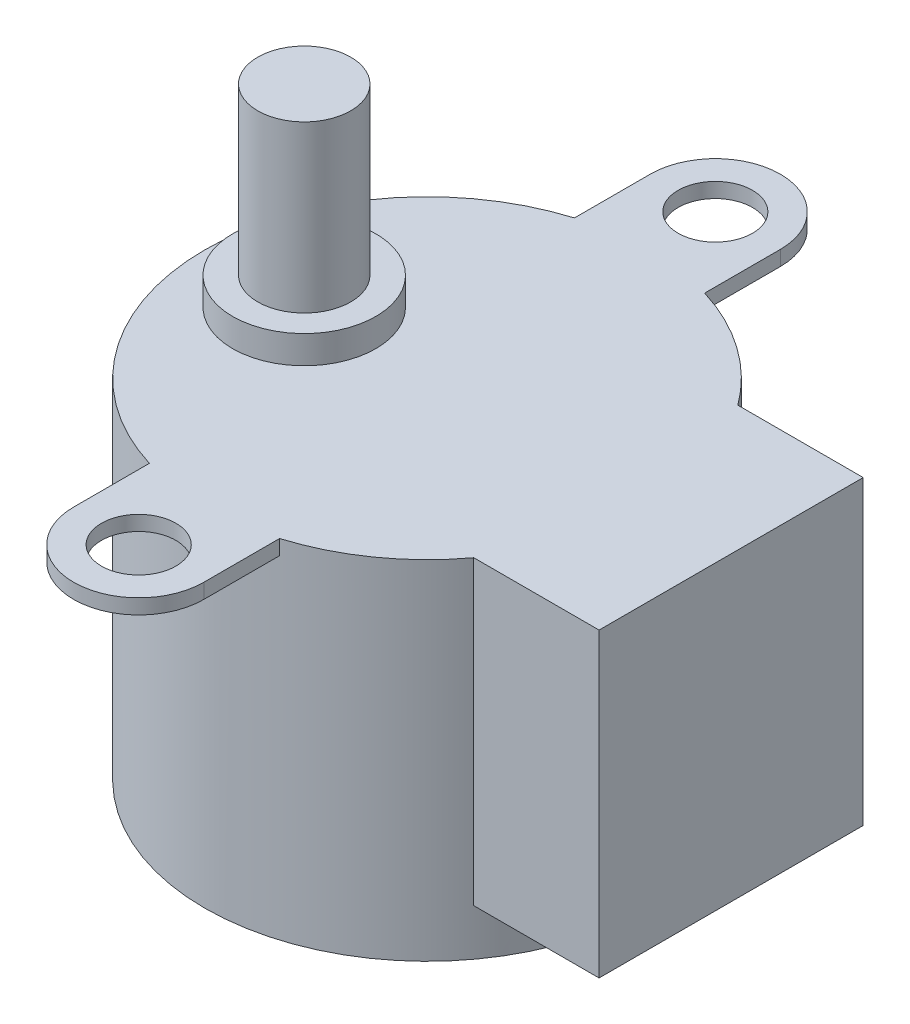
from build123d import *

# Parameters (mm, degrees)
SKETCH_1_R       = 11.95
EXTRUDE_1_DEPTH  = 18.7
EXTRUDE_START    = -16.2
EXTRUDE_8_DEPTH  = 16.2
EXTRUDE_START_2  = -0.8
SKETCH_3_R       = 2
EXTRUDE_9_DEPTH  = 0.8
SKETCH_4_R       = 3.85
EXTRUDE_10_DEPTH = 1.5
SKETCH_5_R       = 2.5
EXTRUDE_11_DEPTH = 8.9


with BuildPart() as part:
    # 草图1 → 凸台-拉伸1 (new body)
    with BuildSketch(Plane(origin=(0, 0, 0), x_dir=(1, 0, 0), z_dir=(0, 1, 0))):
        with Locations(Location((0, 0, 0), (0, 0, 270))):
            Circle(SKETCH_1_R)
    extrude(amount=EXTRUDE_1_DEPTH)

    # 草图2 → 凸台-拉伸8 (add)
    with BuildSketch(Plane(origin=(0, 18.7, 0), x_dir=(1, 0, 0), z_dir=(0, 1, 0)).offset(EXTRUDE_START)):
        with BuildLine():
            ThreePointArc((9.612101747, 7.1), (11.350487123, 3.737504791), (11.95, 0))
            Line((11.95, 0), (16.35, 0))
            Line((16.35, 0), (16.35, 7.1))
            Line((16.35, 7.1), (9.612101747, 7.1))
        make_face()
        with BuildLine():
            Line((16.35, 0), (11.95, 0))
            ThreePointArc((11.95, 0), (11.350487123, -3.737504791), (9.612101747, -7.1))
            Line((9.612101747, -7.1), (16.35, -7.1))
            Line((16.35, -7.1), (16.35, 0))
        make_face()
    extrude(amount=EXTRUDE_8_DEPTH)

    # 草图3 → 凸台-拉伸9 (add)
    # profile 1 of 2: a face of its own
    with BuildSketch(Plane(origin=(0, 18.7, 0), x_dir=(1, 0, 0), z_dir=(0, 1, 0)).offset(EXTRUDE_START_2)):
        with BuildLine():
            Line((-3.5, 15.5), (-3.5, 11.42595729))
            ThreePointArc((-3.5, 11.42595729), (0, 11.95), (3.5, 11.42595729))
            Line((3.5, 11.42595729), (3.5, 15.5))
            ThreePointArc((3.5, 15.5), (0, 19), (-3.5, 15.5))
        make_face()
        with Locations(Location((0, 15.5, 0), (0, 0, 270))):
            Circle(SKETCH_3_R, mode=Mode.SUBTRACT)
    # profile 2 of 2: a face of its own
    with BuildSketch(Plane(origin=(0, 18.7, 0), x_dir=(1, 0, 0), z_dir=(0, 1, 0)).offset(EXTRUDE_START_2)):
        with BuildLine():
            Line((-3.5, -15.5), (-3.5, -11.42595729))
            ThreePointArc((-3.5, -11.42595729), (0, -11.95), (3.5, -11.42595729))
            Line((3.5, -11.42595729), (3.5, -15.5))
            ThreePointArc((3.5, -15.5), (0, -19), (-3.5, -15.5))
        make_face()
        with Locations(Location((0, -15.5, 0), (0, 0, 270))):
            Circle(SKETCH_3_R, mode=Mode.SUBTRACT)
    extrude(amount=EXTRUDE_9_DEPTH)

    # 草图4 → 凸台-拉伸10 (add)
    with BuildSketch(Plane(origin=(0, 18.7, 0), x_dir=(1, 0, 0), z_dir=(0, 1, 0))):
        with Locations(Location((-6.6, 0, 0), (0, 0, 270))):
            Circle(SKETCH_4_R)
    extrude(amount=EXTRUDE_10_DEPTH)

    # 草图5 → 凸台-拉伸11 (add)
    with BuildSketch(Plane(origin=(0, 20.2, 0), x_dir=(1, 0, 0), z_dir=(0, 1, 0))):
        with Locations(Location((-6.6, 0, 0), (0, 0, 270))):
            Circle(SKETCH_5_R)
    extrude(amount=EXTRUDE_11_DEPTH)


solid = part.part
